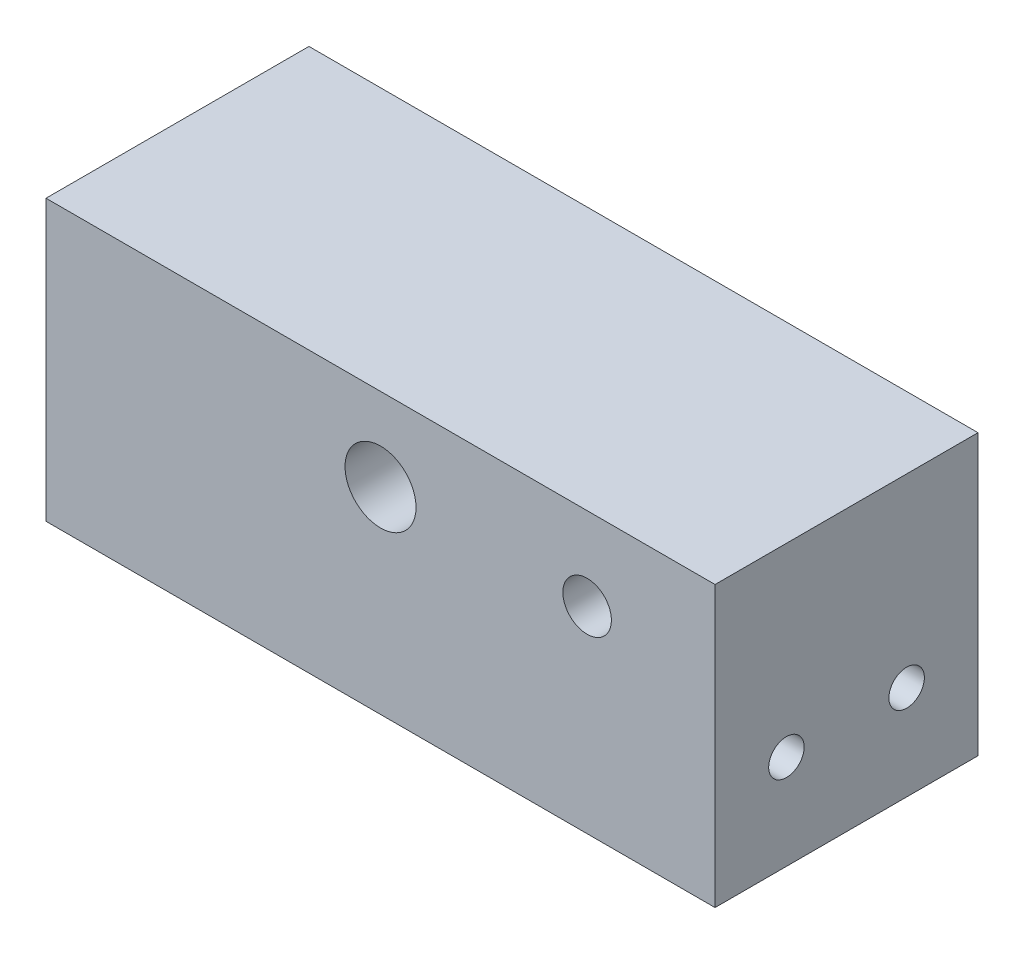
from build123d import *

# Parameters (mm, degrees)
SKETCH1_W           = 56.55
SKETCH1_H           = 22.225
BOSS_EXTRUDE1_DEPTH = 22.225
SKETCH2_R           = 2.05
SKETCH2_R_2         = 3
CUT_EXTRUDE1_DEPTH  = 10
SKETCH3_R           = 1.5
CUT_EXTRUDE2_DEPTH  = 8
SKETCH5_W           = 56.55
SKETCH5_H           = 22.225
BOSS_EXTRUDE2_DEPTH = 1.42494
SKETCH6_R           = 3.025
CUT_EXTRUDE3_DEPTH  = 10


with BuildPart() as part:
    # Sketch1 → Boss-Extrude1 (new body)
    with BuildSketch(Plane.XY):
        Rectangle(SKETCH1_W, SKETCH1_H)
    extrude(amount=BOSS_EXTRUDE1_DEPTH)

    # Sketch2 → Cut-Extrude1 (cut)
    with BuildSketch(Plane.XY.offset(22.225)):
        with Locations((17.4625, 4.1125)):
            Circle(SKETCH2_R)
        with Locations((0, 4.1125)):
            Circle(SKETCH2_R_2)
    extrude(amount=-CUT_EXTRUDE1_DEPTH, mode=Mode.SUBTRACT)

    # Sketch3 → Cut-Extrude2 (cut)
    with BuildSketch(Plane.ZY.offset(28.275)):
        with Locations(Location((16.1925, -4.5375001, 0), (0, 0, 270))):
            Circle(SKETCH3_R)
        with Locations(Location((6.0325, -4.5375001, 0), (0, 0, 270))):
            Circle(SKETCH3_R)
    cut_extrude2 = extrude(amount=-CUT_EXTRUDE2_DEPTH, mode=Mode.SUBTRACT)

    # Sketch5 → Boss-Extrude2 (add)
    with BuildSketch(Plane.XZ.offset(11.1125)):
        with Locations((0, 11.1125)):
            Rectangle(SKETCH5_W, SKETCH5_H)
    extrude(amount=BOSS_EXTRUDE2_DEPTH)

    # Mirror2: Cut-Extrude2 across plane
    add(cut_extrude2.mirror(Plane(origin=(0, 0, 0), x_dir=(0, 0, 1), z_dir=(1, 0, 0))), mode=Mode.SUBTRACT)

    # Sketch6 → Cut-Extrude3 (cut)
    with BuildSketch(Plane(origin=(0, 0, 0), x_dir=(-1, 0, 0), z_dir=(0, 0, -1))):
        with Locations((-10, 1.1125)):
            Circle(SKETCH6_R)
        with Locations((10, 1.1125)):
            Circle(SKETCH6_R)
    extrude(amount=-CUT_EXTRUDE3_DEPTH, mode=Mode.SUBTRACT)


solid = part.part
